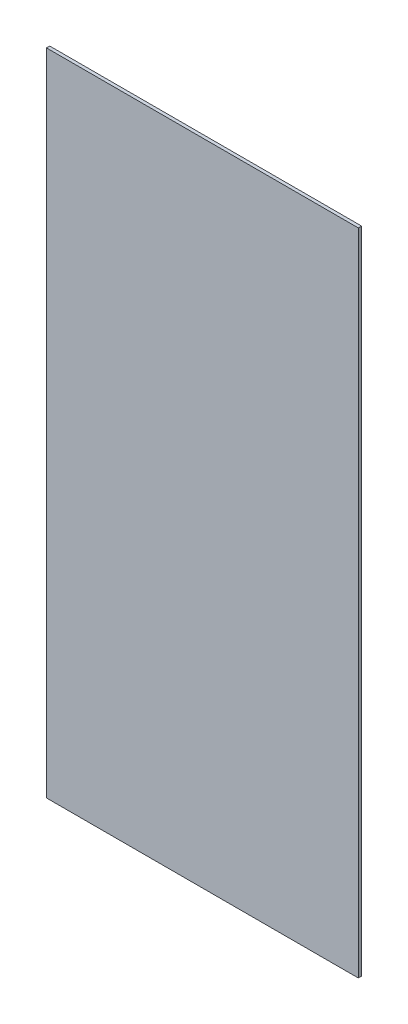
from build123d import *

# Parameters (mm, degrees)
SKETCH_1_W      = 1200
SKETCH_1_H      = 2500
EXTRUDE_1_DEPTH = 12.5


with BuildPart() as part:
    # Эскиз1 → Бобышка-Вытянуть1 (new body)
    with BuildSketch(Plane.XY):
        with Locations((-600, 1250)):
            Rectangle(SKETCH_1_W, SKETCH_1_H)
    extrude(amount=-EXTRUDE_1_DEPTH)


solid = part.part
